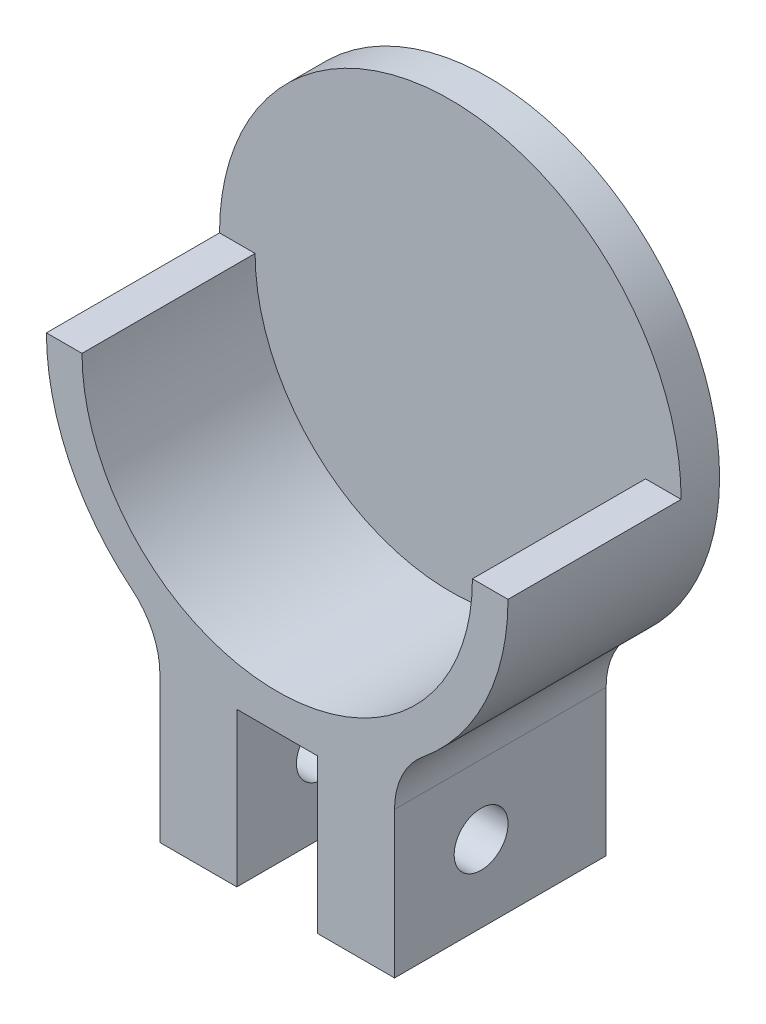
from build123d import *

# Parameters (mm, degrees)
EXTRUDE_1_DEPTH     = 9
SKETCH_3_R          = 1.4
CUT_EXTRUDE_1_DEPTH = 29.436068645
FILLET_1_R          = 4
EXTRUDE_START       = 2
EXTRUDE_2_DEPTH     = 2


with BuildPart() as part:
    # 草图1 → 凸台-拉伸1 (new body)
    with BuildSketch(Plane.XY):
        with BuildLine():
            Line((-6.1, -20), (-2.1, -20))
            Line((-2.1, -20), (-2.1, -12))
            Line((-2.1, -12), (2.1, -12))
            Line((2.1, -12), (2.1, -20))
            Line((2.1, -20), (6.1, -20))
            Line((6.1, -20), (6.1, -10.333924714))
            ThreePointArc((6.1, -10.333924714), (10.421132376, -5.949789912), (12, 0))
            Line((12, 0), (10.15, 0))
            ThreePointArc((10.15, 0), (0, -10.15), (-10.15, 0))
            Line((-10.15, 0), (-12, 0))
            ThreePointArc((-12, 0), (-10.421132376, -5.949789912), (-6.1, -10.333924714))
            Line((-6.1, -10.333924714), (-6.1, -20))
        make_face()
    extrude(amount=EXTRUDE_1_DEPTH)

    # 草图3 → 切除-拉伸1 (cut, through all)
    with BuildSketch(Plane.ZY.offset(6.1)):
        with Locations(Location((4.5, -16, 0), (0, 0, 270))):
            Circle(SKETCH_3_R)
    extrude(amount=-CUT_EXTRUDE_1_DEPTH, mode=Mode.SUBTRACT)

    # 圆角1
    fillet_1_edges = [part.edges().sort_by_distance(p)[0] for p in [
        (-6.1, -10.333924714, 4.5),
        (6.1, -10.333924714, 4.5),
    ]]
    fillet(fillet_1_edges, radius=FILLET_1_R)

    # 草图4 → 凸台-拉伸2 (add)
    with BuildSketch(Plane(origin=(0, 0, 0), x_dir=(-1, 0, 0), z_dir=(0, 0, -1)).offset(EXTRUDE_START)):
        with BuildLine():
            ThreePointArc((12, 0), (0, 12), (-12, 0))
            Line((-12, 0), (-10.15, 0))
            ThreePointArc((-10.15, 0), (0, -10.15), (10.15, 0))
            Line((10.15, 0), (12, 0))
        make_face()
        with BuildLine():
            Line((-2.1, -20), (-2.1, -12))
            Line((-2.1, -12), (2.1, -12))
            Line((2.1, -12), (2.1, -20))
            Line((2.1, -20), (6.1, -20))
            Line((6.1, -20), (6.1, -12.409270728))
            ThreePointArc((6.1, -12.409270728), (6.487521626, -10.691714324), (7.575, -9.306953046))
            ThreePointArc((7.575, -9.306953046), (10.837435121, -5.152669211), (12, 0))
            Line((12, 0), (10.15, 0))
            ThreePointArc((10.15, 0), (0, -10.15), (-10.15, 0))
            Line((-10.15, 0), (-12, 0))
            ThreePointArc((-12, 0), (-10.837435121, -5.152669211), (-7.575, -9.306953046))
            ThreePointArc((-7.575, -9.306953046), (-6.487521626, -10.691714324), (-6.1, -12.409270728))
            Line((-6.1, -12.409270728), (-6.1, -20))
            Line((-6.1, -20), (-2.1, -20))
        make_face()
    extrude(amount=-EXTRUDE_2_DEPTH)


solid = part.part
